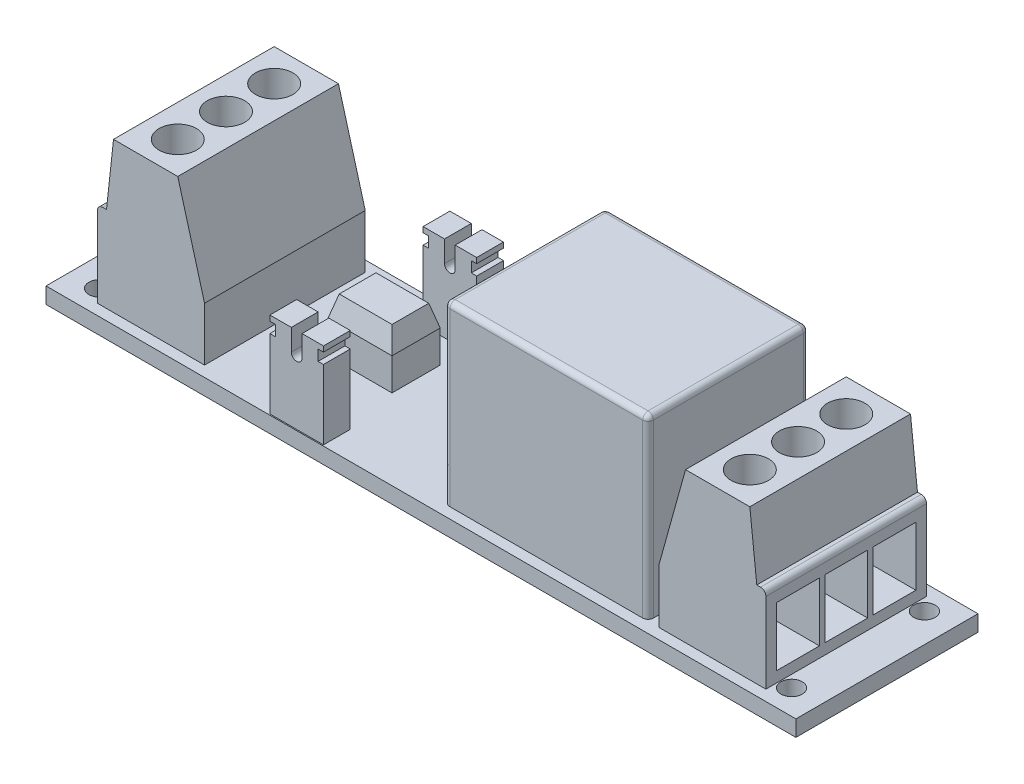
from build123d import *
from OCP.BRepFilletAPI import BRepFilletAPI_MakeChamfer

# Parameters (mm, degrees)
SKETCH1_W            = 70
SKETCH1_H            = 17
SKETCH1_R            = 1
BOSS_EXTRUDE1_DEPTH  = 1.5
BOSS_EXTRUDE2_DEPTH  = 7.5
FILLET1_R            = 0.5
SKETCH3_R            = 1.75
CUT_EXTRUDE1_DEPTH   = 11
SKETCH4_W            = 4
SKETCH4_H            = 5.5
CUT_EXTRUDE2_DEPTH   = 7
FILLET1_OF_MIRROR1_R = 0.5
SKETCH5_W            = 19
SKETCH5_H            = 15
BOSS_EXTRUDE3_DEPTH  = 16.5
FILLET2_R            = 0.5
SKETCH6_W            = 6
SKETCH6_H            = 4.5
BOSS_EXTRUDE4_DEPTH  = 5
CHAMFER1_SIZE        = 2
CHAMFER1_SIZE2       = 0.535898385
SKETCH7_W            = 5
SKETCH7_H            = 2.5
BOSS_EXTRUDE5_DEPTH  = 8
CUT_EXTRUDE3_REACH   = 44.832
SKETCH8_W            = 0.5
SKETCH8_H            = 1


with BuildPart() as part:
    # Sketch1 → Boss-Extrude1 (new body)
    with BuildSketch(Plane(origin=(0, 0, 0), x_dir=(1, 0, 0), z_dir=(0, 1, 0))):
        Rectangle(SKETCH1_W, SKETCH1_H)
        with Locations(Location((-32.3, 6.2, 0), (0, 0, 270))):
            Circle(SKETCH1_R, mode=Mode.SUBTRACT)
        with Locations(Location((32.3, 6.2, 0), (0, 0, 270))):
            Circle(SKETCH1_R, mode=Mode.SUBTRACT)
        with Locations(Location((32.3, -6.2, 0), (0, 0, 270))):
            Circle(SKETCH1_R, mode=Mode.SUBTRACT)
        with Locations(Location((-32.3, -6.2, 0), (0, 0, 270))):
            Circle(SKETCH1_R, mode=Mode.SUBTRACT)
    extrude(amount=BOSS_EXTRUDE1_DEPTH)

    # Sketch2 → Boss-Extrude2 (add, symmetric)
    with BuildSketch(Plane.XY):
        Polygon((-31.2, 1.5), (-31.2, 9.5), (-30.350716041, 9.5), (-29.7, 15.5), (-23.7, 15.5), (-21.2, 6.5), (-21.2, 1.5), align=None)
    boss_extrude2 = extrude(amount=BOSS_EXTRUDE2_DEPTH, both=True)

    # Fillet1
    fillet1_edges = [part.edges().sort_by_distance(p)[0] for p in [
        (-31.2, 9.5, 0),
    ]]
    fillet(fillet1_edges, radius=FILLET1_R)

    # Sketch3 → Cut-Extrude1 (cut)
    with BuildSketch(Plane(origin=(0, 15.5, 0), x_dir=(1, 0, 0), z_dir=(0, 1, 0))):
        with Locations(Location((-26.7, 4.5, 0), (0, 0, 270))):
            Circle(SKETCH3_R)
        with Locations(Location((-26.7, 0, 0), (0, 0, 270))):
            Circle(SKETCH3_R)
        with Locations(Location((-26.7, -4.5, 0), (0, 0, 270))):
            Circle(SKETCH3_R)
    cut_extrude1 = extrude(amount=-CUT_EXTRUDE1_DEPTH, mode=Mode.SUBTRACT)

    # Sketch4 → Cut-Extrude2 (cut)
    with BuildSketch(Plane.ZY.offset(31.2)):
        with Locations((-4.5, 5.25)):
            Rectangle(SKETCH4_W, SKETCH4_H)
        with Locations((0, 5.25)):
            Rectangle(SKETCH4_W, SKETCH4_H)
        with Locations((4.5, 5.25)):
            Rectangle(SKETCH4_W, SKETCH4_H)
    cut_extrude2 = extrude(amount=-CUT_EXTRUDE2_DEPTH, mode=Mode.SUBTRACT)

    # Mirror1: Boss-Extrude2, Cut-Extrude1, Cut-Extrude2 across plane
    add(boss_extrude2.mirror(Plane(origin=(0, 0, 0), x_dir=(0, 0, 1), z_dir=(1, 0, 0))))
    add(cut_extrude1.mirror(Plane(origin=(0, 0, 0), x_dir=(0, 0, 1), z_dir=(1, 0, 0))), mode=Mode.SUBTRACT)
    add(cut_extrude2.mirror(Plane(origin=(0, 0, 0), x_dir=(0, 0, 1), z_dir=(1, 0, 0))), mode=Mode.SUBTRACT)

    # Fillet1 of Mirror1
    fillet1_of_mirror1_edges = [part.edges().sort_by_distance(p)[0] for p in [
        (31.2, 9.5, 0),
    ]]
    fillet(fillet1_of_mirror1_edges, radius=FILLET1_OF_MIRROR1_R)

    # Sketch5 → Boss-Extrude3 (add)
    with BuildSketch(Plane(origin=(0, 1.5, 0), x_dir=(1, 0, 0), z_dir=(0, 1, 0))):
        with Locations((10.7, 0)):
            Rectangle(SKETCH5_W, SKETCH5_H)
    extrude(amount=BOSS_EXTRUDE3_DEPTH)

    # Fillet2
    fillet2_edges = [part.edges().sort_by_distance(p)[0] for p in [
        (20.2, 9.75, 7.5),
        (20.2, 9.75, -7.5),
        (1.2, 9.75, -7.5),
        (1.2, 9.75, 7.5),
        (20.2, 18, 0),
        (10.7, 18, -7.5),
        (1.2, 18, 0),
        (10.7, 18, 7.5),
    ]]
    fillet(fillet2_edges, radius=FILLET2_R)

    # Sketch6 → Boss-Extrude4 (add)
    with BuildSketch(Plane(origin=(0, 1.5, 0), x_dir=(1, 0, 0), z_dir=(0, 1, 0))):
        with Locations((-13.2, 1.25)):
            Rectangle(SKETCH6_W, SKETCH6_H)
    extrude(amount=BOSS_EXTRUDE4_DEPTH)

    # Chamfer1: one chamfer whose edges measure the first distance from different faces: ONE call of the kernel's chamfer builder (chamfer() names one face for all edges)
    chamfer1_edges_1 = [part.edges().sort_by_distance(p)[0] for p in [
        (-16.2, 6.5, -1.25),
    ]]
    chamfer1_side_1 = [part.faces().sort_by_distance(p)[0] for p in [
        (-16.2, 4, -1.25),
    ]]
    chamfer1_edges_2 = [part.edges().sort_by_distance(p)[0] for p in [
        (-13.2, 6.5, 1),
    ]]
    chamfer1_side_2 = [part.faces().sort_by_distance(p)[0] for p in [
        (-13.2, 4, 1),
    ]]
    chamfer1_edges_3 = [part.edges().sort_by_distance(p)[0] for p in [
        (-10.2, 6.5, -1.25),
    ]]
    chamfer1_side_3 = [part.faces().sort_by_distance(p)[0] for p in [
        (-10.2, 4, -1.25),
    ]]
    chamfer1_edges_4 = [part.edges().sort_by_distance(p)[0] for p in [
        (-13.2, 6.5, -3.5),
    ]]
    chamfer1_side_4 = [part.faces().sort_by_distance(p)[0] for p in [
        (-13.2, 4, -3.5),
    ]]
    chamfer1 = BRepFilletAPI_MakeChamfer(part.part.solid().wrapped)
    for e in chamfer1_edges_1:
        chamfer1.Add(CHAMFER1_SIZE, CHAMFER1_SIZE2, e.wrapped, chamfer1_side_1[0].wrapped)  # the first distance lies on this face
    for e in chamfer1_edges_2:
        chamfer1.Add(CHAMFER1_SIZE, CHAMFER1_SIZE2, e.wrapped, chamfer1_side_2[0].wrapped)  # the first distance lies on this face
    for e in chamfer1_edges_3:
        chamfer1.Add(CHAMFER1_SIZE, CHAMFER1_SIZE2, e.wrapped, chamfer1_side_3[0].wrapped)  # the first distance lies on this face
    for e in chamfer1_edges_4:
        chamfer1.Add(CHAMFER1_SIZE, CHAMFER1_SIZE2, e.wrapped, chamfer1_side_4[0].wrapped)  # the first distance lies on this face
    add(Compound.cast(chamfer1.Shape()), mode=Mode.REPLACE)

    # Sketch7 → Boss-Extrude5 (add)
    with BuildSketch(Plane(origin=(0, 1.5, 0), x_dir=(1, 0, 0), z_dir=(0, 1, 0))):
        with Locations((-11.7, -7.15)):
            Rectangle(SKETCH7_W, SKETCH7_H)
    boss_extrude5 = extrude(amount=BOSS_EXTRUDE5_DEPTH)

    # Sketch8 → Cut-Extrude3 (cut, up to next)
    with BuildSketch(Plane.XY.offset(8.4), mode=Mode.PRIVATE) as cut_extrude3_sk1:
        with Locations((-13.95, 8.5)):
            Rectangle(SKETCH8_W, SKETCH8_H)
    cut_extrude3_tool1 = extrude(cut_extrude3_sk1.sketch, amount=-CUT_EXTRUDE3_REACH, mode=Mode.PRIVATE) & part.part
    # Sketch8 → Cut-Extrude3 (cut, up to next)
    with BuildSketch(Plane.XY.offset(8.4), mode=Mode.PRIVATE) as cut_extrude3_sk2:
        with BuildLine():
            Line((-12.2, 7.5), (-12.2, 9.5))
            Line((-12.2, 9.5), (-11.2, 9.5))
            Line((-11.2, 9.5), (-11.2, 7.5))
            ThreePointArc((-11.2, 7.5), (-11.7, 7), (-12.2, 7.5))
        make_face()
    cut_extrude3_tool2 = extrude(cut_extrude3_sk2.sketch, amount=-CUT_EXTRUDE3_REACH, mode=Mode.PRIVATE) & part.part
    # Sketch8 → Cut-Extrude3 (cut, up to next)
    with BuildSketch(Plane.XY.offset(8.4), mode=Mode.PRIVATE) as cut_extrude3_sk3:
        with Locations((-9.45, 8.5)):
            Rectangle(SKETCH8_W, SKETCH8_H)
    cut_extrude3_tool3 = extrude(cut_extrude3_sk3.sketch, amount=-CUT_EXTRUDE3_REACH, mode=Mode.PRIVATE) & part.part
    cut_extrude3_1 = cut_extrude3_tool1.solids().sort_by_distance((-13.95, 8.5, 8.4))[0]
    add(cut_extrude3_1, mode=Mode.SUBTRACT)
    cut_extrude3_2 = cut_extrude3_tool2.solids().sort_by_distance((-11.7, 8.301048, 8.4))[0]
    add(cut_extrude3_2, mode=Mode.SUBTRACT)
    cut_extrude3_3 = cut_extrude3_tool3.solids().sort_by_distance((-9.45, 8.5, 8.4))[0]
    add(cut_extrude3_3, mode=Mode.SUBTRACT)
    cut_extrude3 = cut_extrude3_1 + cut_extrude3_2 + cut_extrude3_3  # Cut-Extrude3 as one shape, for the pattern or mirror that repeats it

    # Mirror2: Boss-Extrude5, Cut-Extrude3 across plane
    add(boss_extrude5.mirror(Plane.XY))
    add(cut_extrude3.mirror(Plane.XY), mode=Mode.SUBTRACT)


solid = part.part
